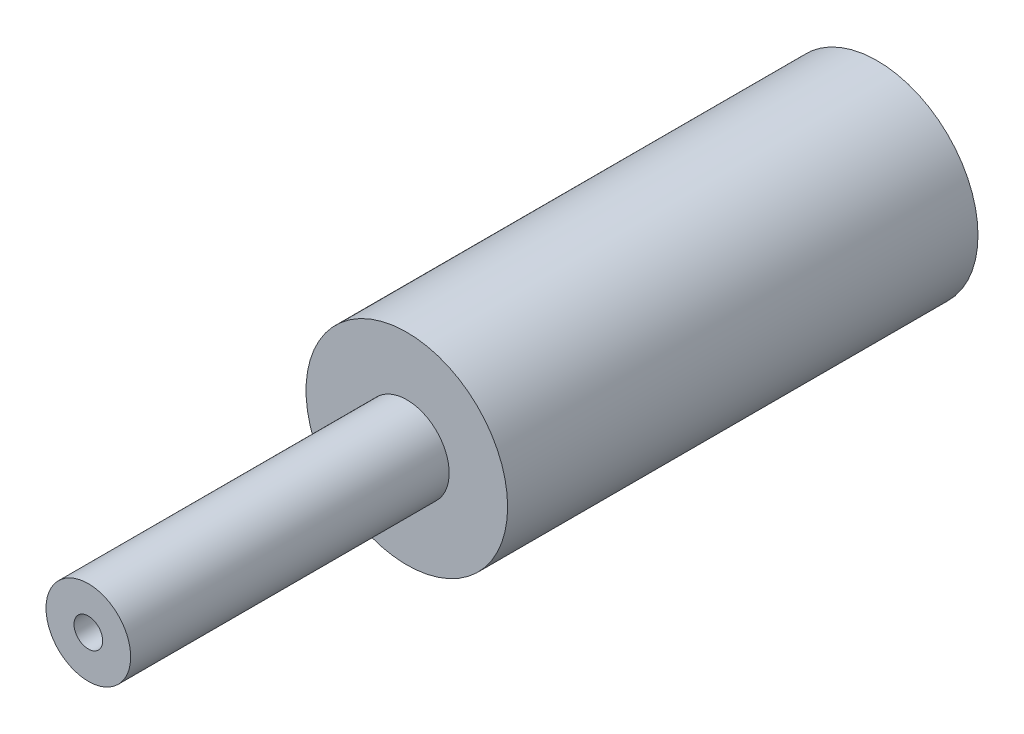
from build123d import *

# Parameters (mm, degrees)
SKETCH1_R           = 9.525
BOSS_EXTRUDE1_DEPTH = 44.45
SKETCH2_R           = 4
BOSS_EXTRUDE2_DEPTH = 30.099
SKETCH3_R           = 1.35255
CUT_EXTRUDE1_DEPTH  = 17.78


with BuildPart() as part:
    # Sketch1 → Boss-Extrude1 (new body)
    with BuildSketch(Plane.XY):
        Circle(SKETCH1_R)
    extrude(amount=BOSS_EXTRUDE1_DEPTH)

    # Sketch2 → Boss-Extrude2 (add)
    with BuildSketch(Plane.XY.offset(44.45)):
        with Locations(Location((0, 0, 0), (0, 0, 180))):
            Circle(SKETCH2_R)
    extrude(amount=BOSS_EXTRUDE2_DEPTH)

    # Sketch3 → Cut-Extrude1 (cut)
    with BuildSketch(Plane.XY.offset(74.549)):
        Circle(SKETCH3_R)
    extrude(amount=-CUT_EXTRUDE1_DEPTH, mode=Mode.SUBTRACT)


solid = part.part
